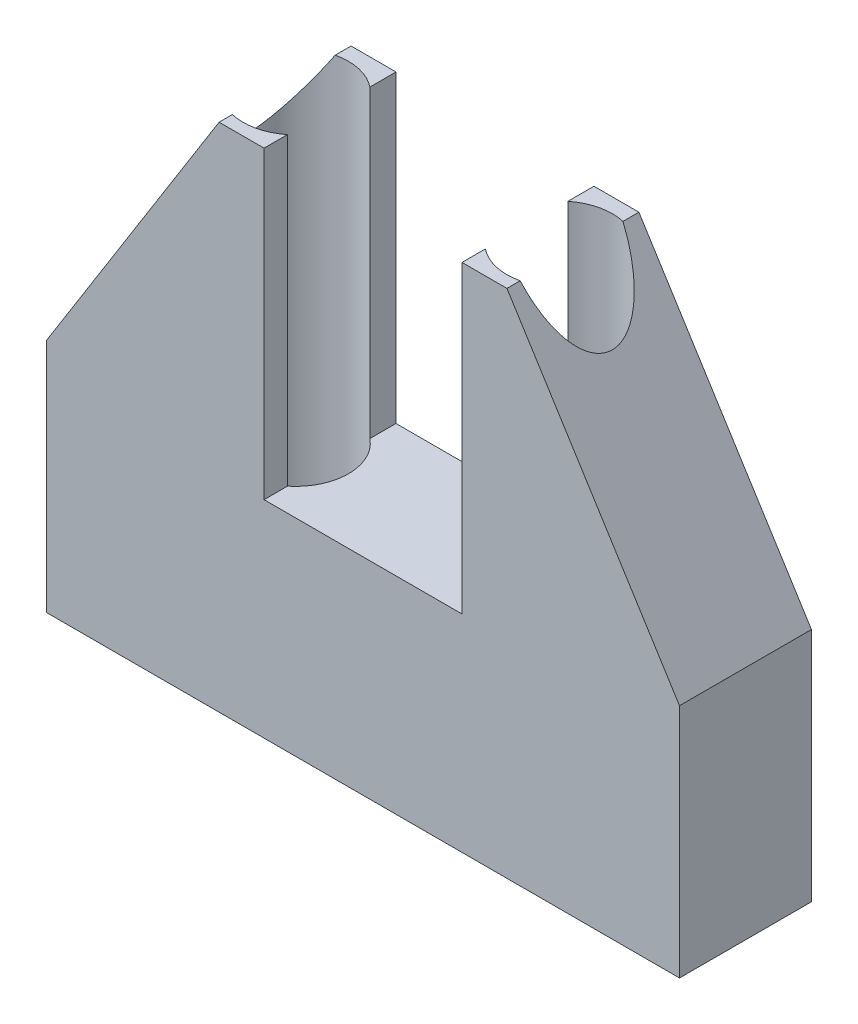
from build123d import *

# Parameters (mm, degrees)
BOSS_EXTRUDE1_DEPTH   = 10
F_8_0MM_DOWEL_HOLE1_D = 8


with BuildPart() as part:
    # Sketch1 → Boss-Extrude1 (new body)
    with BuildSketch(Plane.XY):
        Polygon((-23.981742881, 0), (23.981742881, 0), (23.981742881, 17.869578459), (10.906262583, 38.719668664), (7.5, 38.719668664), (7.5, 15.649448466), (-7.5, 15.649448466), (-7.5, 38.719668664), (-10.906262583, 38.719668664), (-23.981742881, 17.869578459), align=None)
    extrude(amount=BOSS_EXTRUDE1_DEPTH)

    # Ø8.0mm Dowel Hole1 (through all)
    with Locations(Plane(origin=(0, 0, 0), x_dir=(-1, 0, 0), z_dir=(0, -1, 0))):
        with Locations((10, -5.102347766), (-10, -5.102347766)):
            Hole(F_8_0MM_DOWEL_HOLE1_D / 2)


solid = part.part
